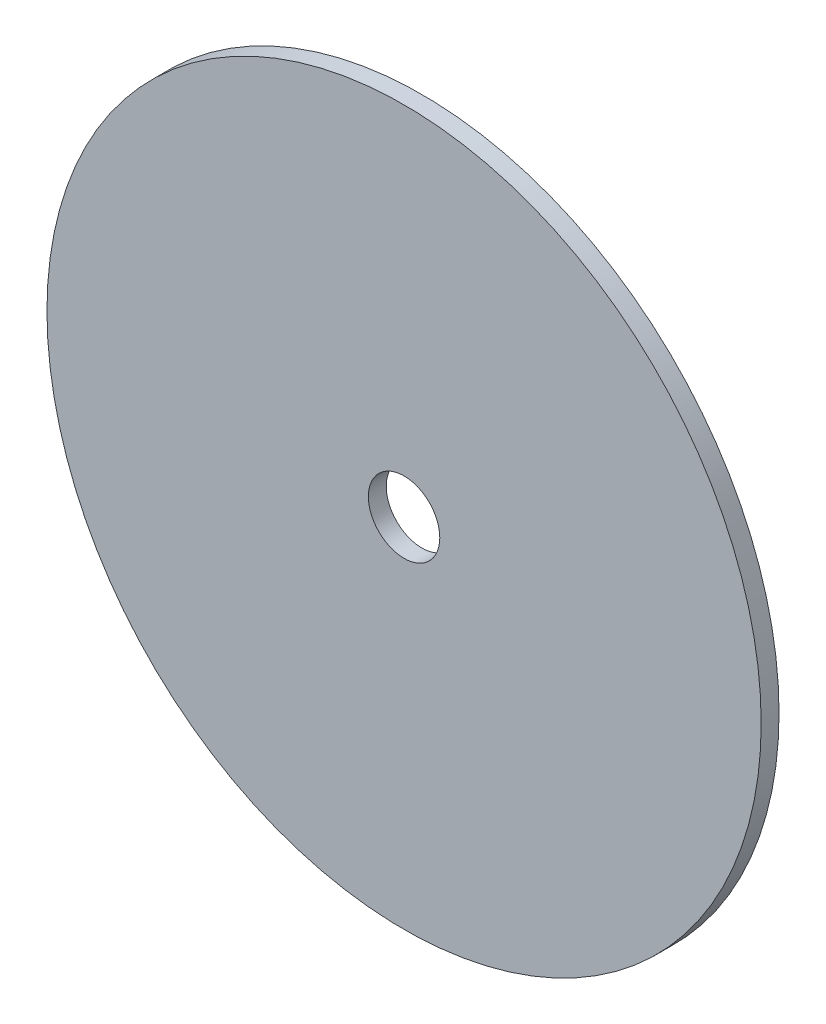
from build123d import *

# Parameters (mm, degrees)
SKETCH1_R           = 20
SKETCH1_R_2         = 2
BOSS_EXTRUDE1_DEPTH = 1


with BuildPart() as part:
    # Sketch1 → Boss-Extrude1 (new body)
    with BuildSketch(Plane.XY):
        Circle(SKETCH1_R)
        Circle(SKETCH1_R_2, mode=Mode.SUBTRACT)
    extrude(amount=BOSS_EXTRUDE1_DEPTH)


solid = part.part
